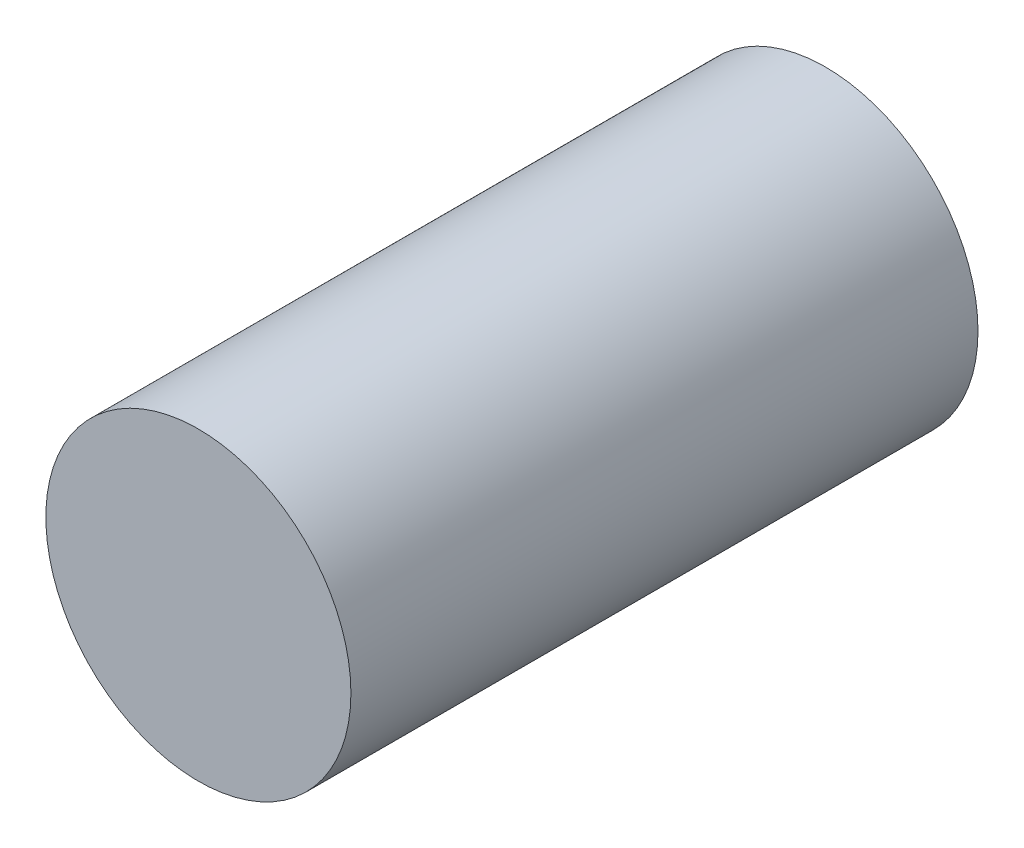
from build123d import *

# Parameters (mm, degrees)
SKETCH1_R           = 18
BOSS_EXTRUDE1_DEPTH = 74


with BuildPart() as part:
    # Sketch1 → Boss-Extrude1 (new body)
    with BuildSketch(Plane.XY):
        Circle(SKETCH1_R)
    extrude(amount=-BOSS_EXTRUDE1_DEPTH)


solid = part.part
